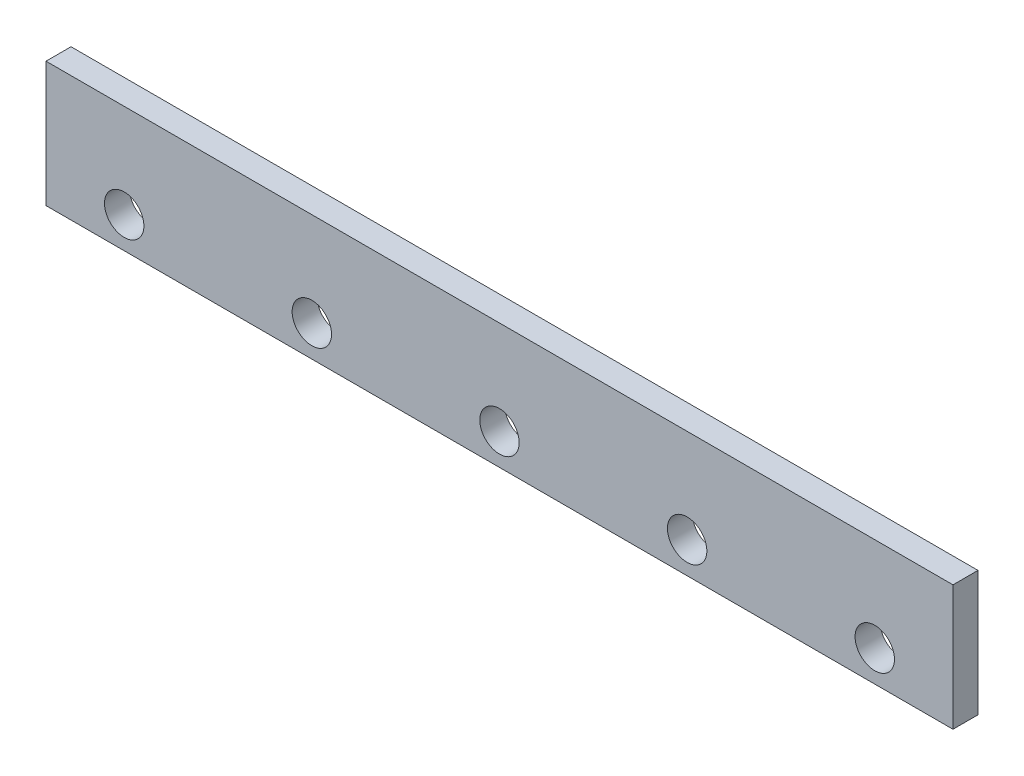
from build123d import *

# Parameters (mm, degrees)
SKETCH1_W           = 580
SKETCH1_H           = 80
BOSS_EXTRUDE1_DEPTH = 8
SKETCH2_R           = 12.6
CUT_EXTRUDE1_DEPTH  = 294.182536997


with BuildPart() as part:
    # Sketch1 → Boss-Extrude1 (new, symmetric)
    with BuildSketch(Plane.XY):
        Rectangle(SKETCH1_W, SKETCH1_H)
    extrude(amount=BOSS_EXTRUDE1_DEPTH, both=True)

    # Sketch2 → Cut-Extrude1 (cut, through all)
    with BuildSketch(Plane.XY.offset(8)):
        with Locations((-240, -20)):
            Circle(SKETCH2_R)
        with Locations((-120, -20)):
            Circle(SKETCH2_R)
        with Locations((0, -20)):
            Circle(SKETCH2_R)
        with Locations(Location((120, -20, 0), (0, 0, 180))):
            Circle(SKETCH2_R)
        with Locations(Location((240, -20, 0), (0, 0, 180))):
            Circle(SKETCH2_R)
    extrude(amount=-CUT_EXTRUDE1_DEPTH, mode=Mode.SUBTRACT)


solid = part.part
